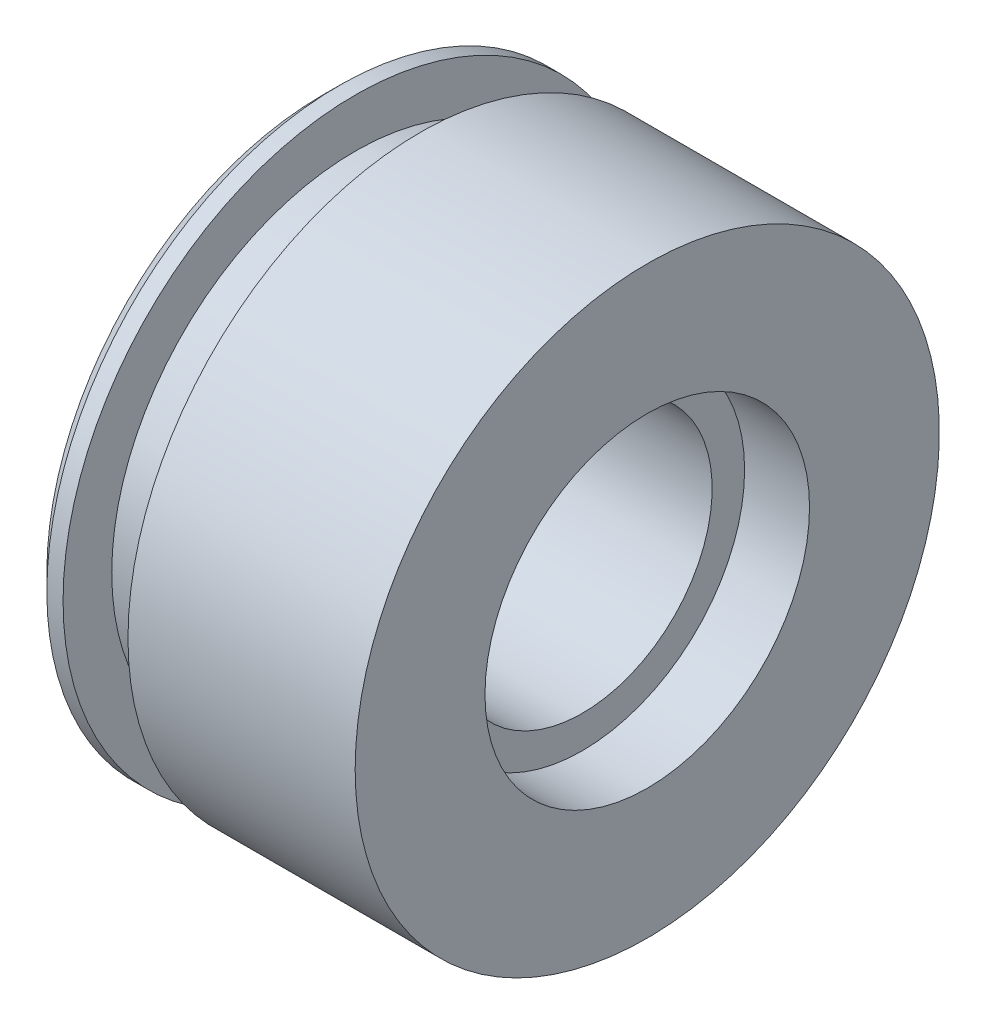
from build123d import *


with BuildPart() as part:
    # Croquis1 → Revolución2 (revolve)
    with BuildSketch(Plane(origin=(0, 0, 0), x_dir=(1, 0, 0), z_dir=(0, 1, 0)), mode=Mode.PRIVATE) as revoluci_n2_sk:
        Polygon((0, 4), (8, 4), (8, 5), (10, 5), (10, 9), (3, 9), (3, 7.5), (1, 7.5), (1, 9), (0.5, 9), (0, 8.5), align=None)
    revolve(revoluci_n2_sk.sketch.rotate(Axis((0, 0, 0), (1, 0, 0)), 180), axis=Axis((0, 0, 0), (1, 0, 0)))


solid = part.part
